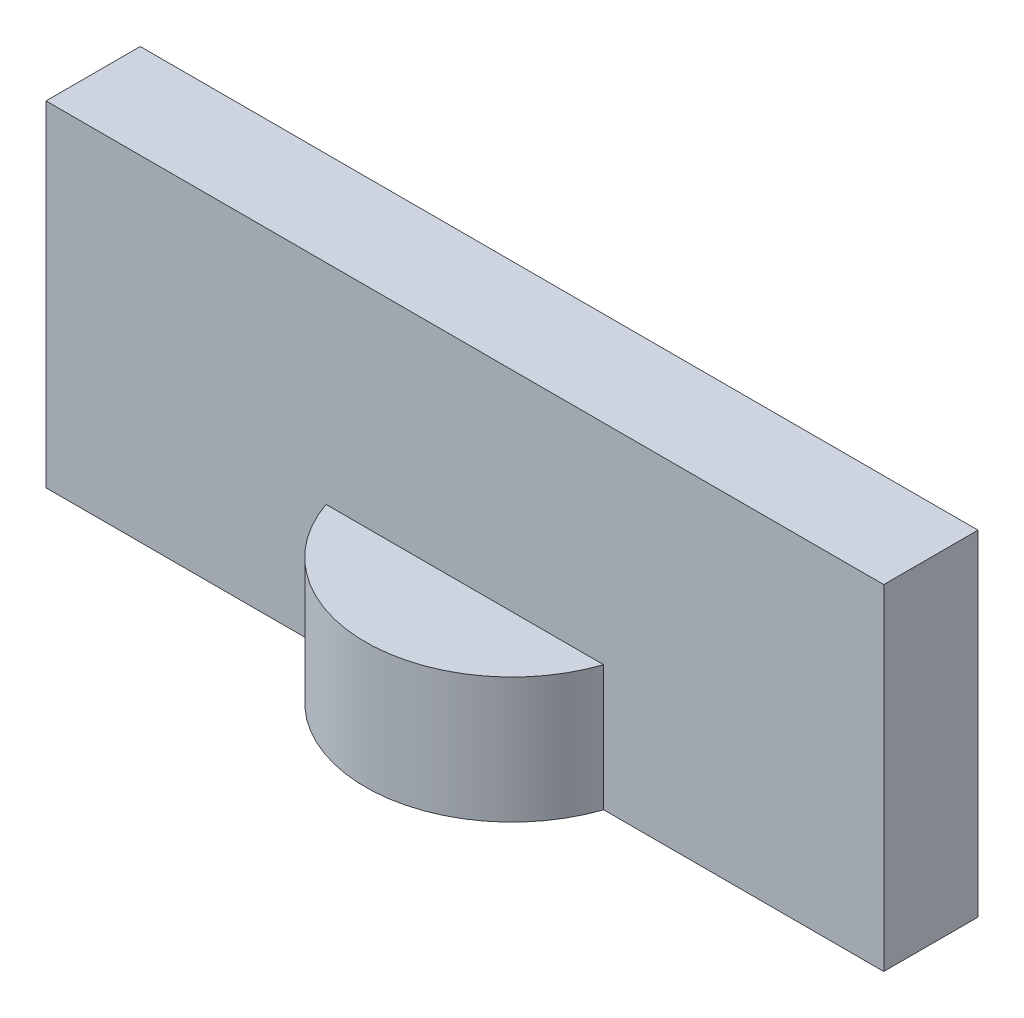
from build123d import *

# Parameters (mm, degrees)
SKETCH1_R           = 4.445
BOSS_EXTRUDE1_DEPTH = 3.81
SKETCH2_W           = 25.4
SKETCH2_H           = 2.8575
BOSS_EXTRUDE2_DEPTH = 10.16


with BuildPart() as part:
    # Sketch1 → Boss-Extrude1 (new body)
    with BuildSketch(Plane(origin=(0, 0, 0), x_dir=(1, 0, 0), z_dir=(0, 1, 0))):
        with Locations(Location((0, 0, 0), (0, 0, 90))):
            Circle(SKETCH1_R)
    extrude(amount=BOSS_EXTRUDE1_DEPTH)

    # Sketch2 → Boss-Extrude2 (add)
    with BuildSketch(Plane(origin=(0, 0, 0), x_dir=(1, 0, 0), z_dir=(0, 1, 0))):
        Rectangle(SKETCH2_W, SKETCH2_H)
    extrude(amount=BOSS_EXTRUDE2_DEPTH)


solid = part.part
